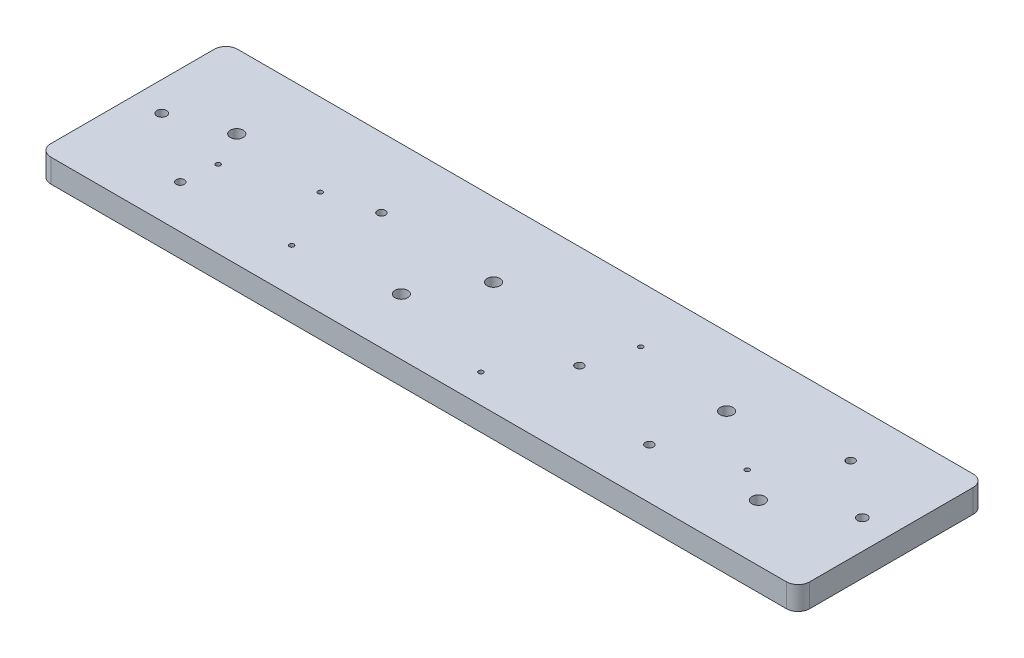
from build123d import *

# Parameters (mm, degrees)
SKETCH1_W                  = 650
SKETCH1_H                  = 160
BOSS_EXTRUDE1_DEPTH        = 20
FILLET1_R                  = 10
F_11_0_11_DIAMETER_HOLE1_D = 11
F_7_0_7_DIAMETER_HOLE1_D   = 7
F_4_0_4_DIAMETER_HOLE1_D   = 4
M8_CLEARANCE_HOLE1_D       = 8.4


with BuildPart() as part:
    # Sketch1 → Boss-Extrude1 (new body)
    with BuildSketch(Plane(origin=(0, 0, 0), x_dir=(1, 0, 0), z_dir=(0, 1, 0))):
        with Locations((325, 80)):
            Rectangle(SKETCH1_W, SKETCH1_H)
    extrude(amount=BOSS_EXTRUDE1_DEPTH)

    # Fillet1
    fillet1_edges = [part.edges().sort_by_distance(p)[0] for p in [
        (0, 10, 0),
        (650, 10, 0),
        (650, 10, -160),
        (0, 10, -160),
    ]]
    fillet(fillet1_edges, radius=FILLET1_R)

    # Ø11.0 (11) Diameter Hole1 (through all)
    with Locations(Plane(origin=(0, 20, 0), x_dir=(1, 0, 0), z_dir=(0, 1, 0))):
        with Locations((72.352582635, 96.89911856), (261.667898073, 48.548804186), (487.756692049, 100.98506062), (567.432562216, 48.548804186), (292.312463521, 96.89911856)):
            Hole(F_11_0_11_DIAMETER_HOLE1_D / 2)

    # Ø7.0 (7) Diameter Hole1 (through all)
    with Locations(Plane(origin=(0, 20, 0), x_dir=(1, 0, 0), z_dir=(0, 1, 0))):
        with Locations((192.887873399, 100.304070277), (83.929418471, 36.97196835), (391.0560633, 71.702475858), (577.647417365, 117.32882886), (479.58480793, 43.10088144)):
            Hole(F_7_0_7_DIAMETER_HOLE1_D / 2)

    # Ø4.0 (4) Diameter Hole1 (through all)
    with Locations(Plane(origin=(0, 20, 0), x_dir=(1, 0, 0), z_dir=(0, 1, 0))):
        with Locations((178.58707619, 37.652958693), (151.347462458, 89.408224784), (353.601594419, 24.71414217), (403.31388948, 111.880906113), (540.192948484, 66.254553112), (87.007836042, 66.254553112)):
            Hole(F_4_0_4_DIAMETER_HOLE1_D / 2)

    # M8 Clearance Hole1 (through all)
    with Locations(Plane(origin=(0, 20, 0), x_dir=(1, 0, 0), z_dir=(0, 1, 0))):
        with Locations((625, 80), (25, 80)):
            Hole(M8_CLEARANCE_HOLE1_D / 2)


solid = part.part
